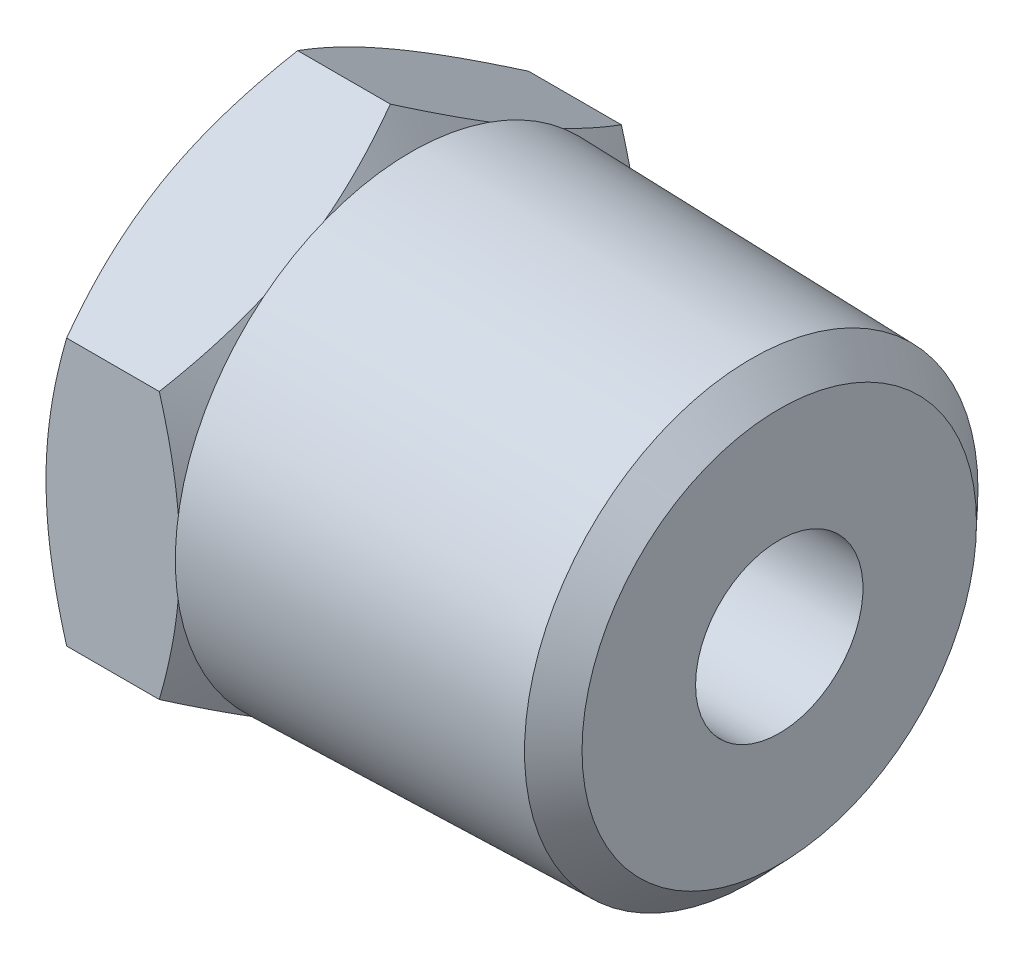
from build123d import *

# Parameters (mm, degrees)
SKETCH2_R          = 8.5725
EXTRUDE1_DEPTH     = 13.97
EXTRUDE1_DRAFT     = 1.5
CHAMFER1_SIZE      = 1.062566667
CHAMFER1_SIZE2     = 1.091513185
EXTRUDE2_DEPTH     = 5.08
SKETCH12_OUTSIDE_W = 110.834
SKETCH12_OUTSIDE_H = 113.196
SKETCH12_OUTSIDE_R = 8.763
CUT_EXTRUDE6_DEPTH = 24.349152203
CUT_EXTRUDE6_DRAFT = -60
SKETCH13_OUTSIDE_W = 97.25
SKETCH13_OUTSIDE_H = 99.612
SKETCH13_OUTSIDE_R = 8.763
CUT_EXTRUDE7_DEPTH = 20.42784879
CUT_EXTRUDE7_DRAFT = -60
SKETCH16_R         = 3.175
CUT_EXTRUDE8_DEPTH = 24.349152203


with BuildPart() as part:
    # Sketch2 → Extrude1 (with draft: the straight prism first)
    with BuildSketch(Plane(origin=(9.525, 0, 0), x_dir=(0, 0, -1), z_dir=(1, 0, 0))):
        Circle(SKETCH2_R)
    extrude(amount=-EXTRUDE1_DEPTH)
    # Extrude1: the draft: its side faces are tilted about the plane it starts from
    extrude1_sides = [part.faces().sort_by_distance(p)[0] for p in [
        (2.54, 0, 8.5725),
    ]]
    draft(extrude1_sides, Plane(origin=(9.525, 0, 0), x_dir=(0, 0, -1), z_dir=(1, 0, 0)), EXTRUDE1_DRAFT)

    # Chamfer1
    chamfer1_edges = [part.edges().sort_by_distance(p)[0] for p in [
        (9.525, 0, 8.5725),
    ]]
    chamfer1_side = [part.faces().sort_by_distance(p)[0] for p in [
        (2.54, 0, 8.755408662),
    ]]
    chamfer(chamfer1_edges, length=CHAMFER1_SIZE, length2=CHAMFER1_SIZE2, reference=chamfer1_side[0])

    # Sketch5 → Extrude2 (add)
    with BuildSketch(Plane.ZY.offset(4.445)):
        Polygon((0, 10.118640818), (-8.763, 5.059320409), (-8.763, -5.059320409), (0, -10.118640818), (8.763, -5.059320409), (8.763, 5.059320409), align=None)
    extrude(amount=EXTRUDE2_DEPTH)


with BuildPart() as cut_extrude6_tool:
    # Sketch12 outside → Cut-Extrude6 (with draft: the straight prism first)
    with BuildSketch(Plane.ZY.offset(9.525)):
        Rectangle(SKETCH12_OUTSIDE_W, SKETCH12_OUTSIDE_H)
        Circle(SKETCH12_OUTSIDE_R, mode=Mode.SUBTRACT)
    extrude(amount=-CUT_EXTRUDE6_DEPTH)
    # Cut-Extrude6: the draft: its side faces are tilted about the plane it starts from
    cut_extrude6_sides = [cut_extrude6_tool.faces().sort_by_distance(p)[0] for p in [
        (2.649576101, -56.598, 0),
        (2.649576101, 0, 55.417),
        (2.649576101, 56.598, 0),
        (2.649576101, 0, -55.417),
        (2.649576101, 0, -8.763),
    ]]
    draft(cut_extrude6_sides, Plane.ZY.offset(9.525), CUT_EXTRUDE6_DRAFT)


with BuildPart() as part_1:
    add(part.part)

    # Cut-Extrude6: cut by cut_extrude6_tool
    add(cut_extrude6_tool.part, mode=Mode.SUBTRACT)


with BuildPart() as cut_extrude7_tool:
    # Sketch13 outside → Cut-Extrude7 (with draft: the straight prism first)
    with BuildSketch(Plane(origin=(-4.445, 0, 0), x_dir=(0, 0, -1), z_dir=(1, 0, 0))):
        Rectangle(SKETCH13_OUTSIDE_W, SKETCH13_OUTSIDE_H)
        Circle(SKETCH13_OUTSIDE_R, mode=Mode.SUBTRACT)
    extrude(amount=-CUT_EXTRUDE7_DEPTH)
    # Cut-Extrude7: the draft: its side faces are tilted about the plane it starts from
    cut_extrude7_sides = [cut_extrude7_tool.faces().sort_by_distance(p)[0] for p in [
        (-14.658924395, -49.806, 0),
        (-14.658924395, 0, -48.625),
        (-14.658924395, 49.806, 0),
        (-14.658924395, 0, 48.625),
        (-14.658924395, 0, 8.763),
    ]]
    draft(cut_extrude7_sides, Plane(origin=(-4.445, 0, 0), x_dir=(0, 0, -1), z_dir=(1, 0, 0)), CUT_EXTRUDE7_DRAFT)


with BuildPart() as part_2:
    add(part_1.part)

    # Cut-Extrude7: cut by cut_extrude7_tool
    add(cut_extrude7_tool.part, mode=Mode.SUBTRACT)

    # Sketch16 → Cut-Extrude8 (cut, through all)
    with BuildSketch(Plane.ZY.offset(9.525)):
        Circle(SKETCH16_R)
    extrude(amount=-CUT_EXTRUDE8_DEPTH, mode=Mode.SUBTRACT)


solid = part_2.part
